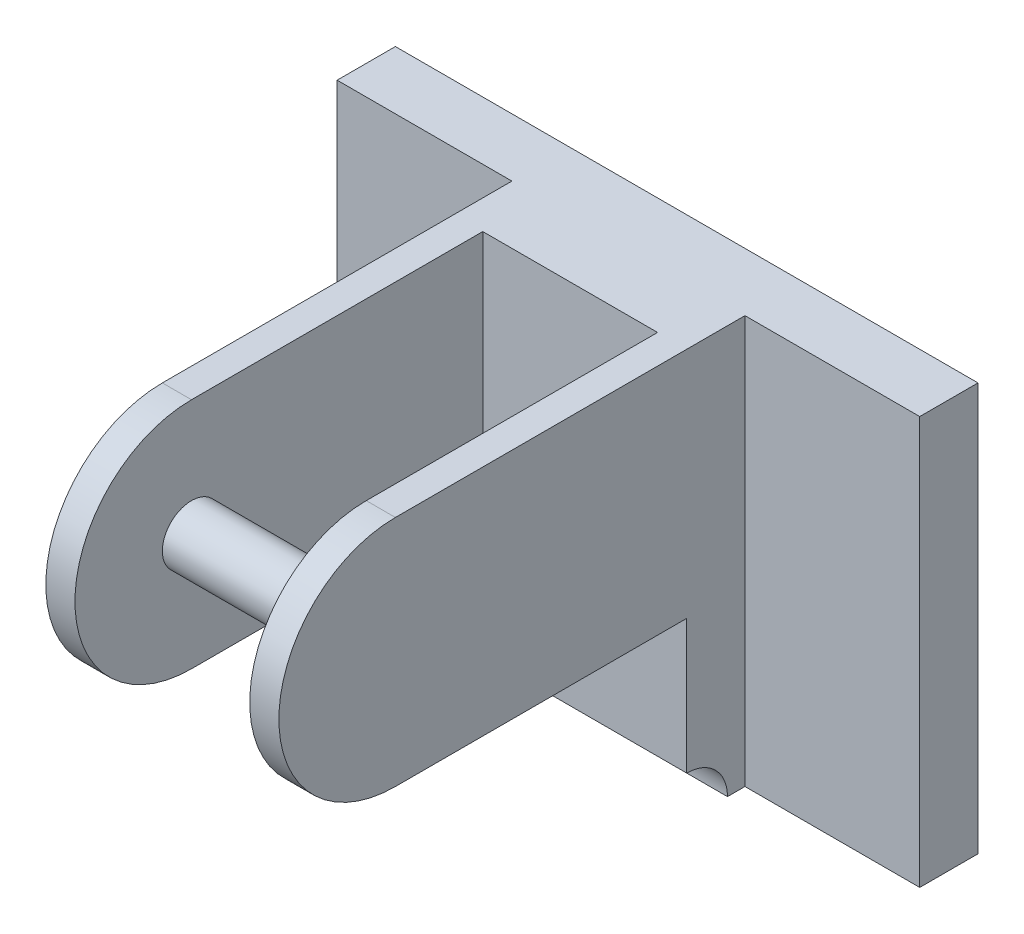
from build123d import *

# Parameters (mm, degrees)
SKETCH_1_W          = 100
SKETCH_1_H          = 70
EXTRUDE_1_DEPTH     = 10
SKETCH_2_W          = 40
SKETCH_2_H          = 70
EXTRUDE_2_DEPTH     = 10
CUT_EXTRUDE_1_DEPTH = 81.777472107
SKETCH_4_W          = 50
SKETCH_4_H          = 40
EXTRUDE_3_DEPTH     = 5
EXTRUDE_START       = -5
SKETCH_5_W          = 50
SKETCH_5_H          = 40
EXTRUDE_4_DEPTH     = 5
SKETCH_6_R          = 5
EXTRUDE_5_DEPTH     = 30


with BuildPart() as part:
    # 草圖1 → 填料-伸長1 (new body)
    with BuildSketch(Plane.XY):
        Rectangle(SKETCH_1_W, SKETCH_1_H)
    extrude(amount=EXTRUDE_1_DEPTH)

    # 草圖2 → 填料-伸長2 (add)
    with BuildSketch(Plane.XY.offset(10)):
        Rectangle(SKETCH_2_W, SKETCH_2_H)
    extrude(amount=EXTRUDE_2_DEPTH)

    # 草圖3 → 除料-伸長1 (cut, through all)
    with BuildSketch(Plane(origin=(20, 0, 0), x_dir=(0, 0, -1), z_dir=(1, 0, 0))):
        with BuildLine():
            Line((-20, -35), (-20, -28))
            ThreePointArc((-20, -28), (-15.050252532, -30.050252532), (-13, -35))
            Line((-13, -35), (-20, -35))
        make_face()
    extrude(amount=-CUT_EXTRUDE_1_DEPTH, mode=Mode.SUBTRACT)

    # 草圖4 → 填料-伸長3 (add)
    with BuildSketch(Plane(origin=(20, 0, 0), x_dir=(0, 0, -1), z_dir=(1, 0, 0))):
        with Locations((-45, 15)):
            Rectangle(SKETCH_4_W, SKETCH_4_H)
        with BuildLine():
            Line((-70, 35), (-70, -5))
            ThreePointArc((-70, -5), (-90, 15), (-70, 35))
        make_face()
    extrude(amount=-EXTRUDE_3_DEPTH)

    # 草圖5 → 填料-伸長4 (add)
    with BuildSketch(Plane.ZY.offset(20).offset(EXTRUDE_START)):
        with Locations((45, 15)):
            Rectangle(SKETCH_5_W, SKETCH_5_H)
        with BuildLine():
            Line((70, 35), (70, -5))
            ThreePointArc((70, -5), (90, 15), (70, 35))
        make_face()
    extrude(amount=EXTRUDE_4_DEPTH)

    # 草圖6 → 填料-伸長5 (add)
    with BuildSketch(Plane(origin=(-15, 0, 0), x_dir=(0, 0, -1), z_dir=(1, 0, 0))):
        with Locations(Location((-70, 15, 0), (0, 0, 180))):
            Circle(SKETCH_6_R)
    extrude(amount=EXTRUDE_5_DEPTH)


solid = part.part
